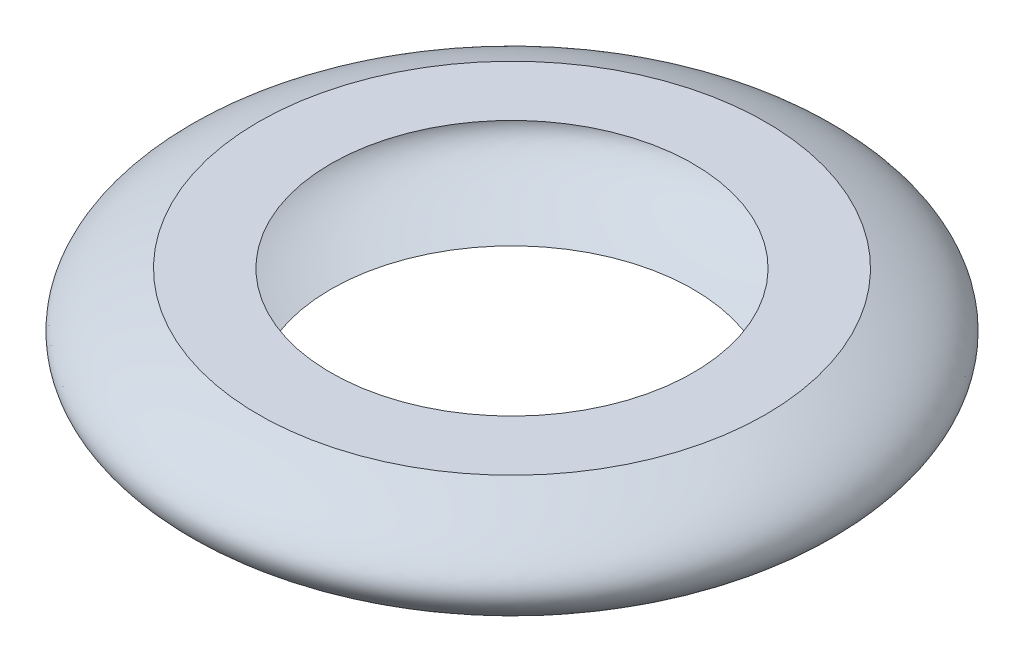
from build123d import *


with BuildPart() as part:
    # Sketch2 → Revolve1 (revolve)
    with BuildSketch(Plane.XY):
        with BuildLine():
            Line((-12.5, 7.5), (-17.5, 7.5))
            add(Edge.make_bspline(
                [(-17.5, 0), (-28, 3.75), (-17.5, 7.5)],
                knots=[0, 0, 0, 1, 1, 1], degree=2))
            Line((-17.5, 0), (-12.5, 0))
            add(Edge.make_bspline(
                [(-12.5, 0), (-23, 3.75), (-12.5, 7.5)],
                knots=[0, 0, 0, 1, 1, 1], degree=2))
        make_face()
    revolve(axis=Axis((0, 7.5, 0), (0, -1, 0)))


solid = part.part
